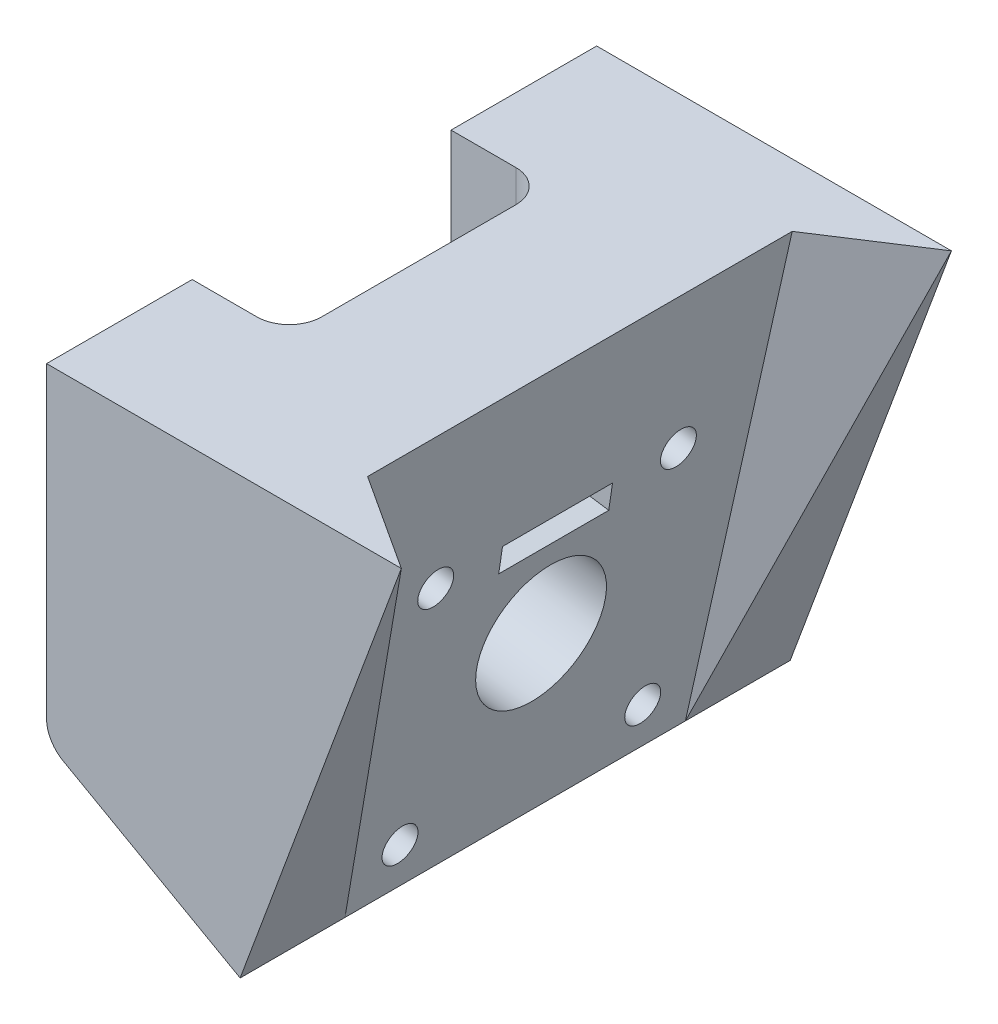
from build123d import *

# Parameters (mm, degrees)
EXTRUDE_1_DEPTH             = 34
CUT_EXTRUDE_1_DEPTH         = 34
CUT_EXTRUDE_12_DEPTH        = 147.490797926
FILLET_1_R                  = 2
CUT_EXTRUDE_13_DEPTH        = 166.02110084
CUT_EXTRUDE_14_DEPTH        = 141.242418962
CUT_EXTRUDE_15_DEPTH        = 141.242418962
EXTRUDE_2_DEPTH             = 34
CUT_EXTRUDE_16_DEPTH        = 141.410480916
EXTRUDE_3_REACH             = 158.273
EXTRUDE_3_DIRECTION_2_REACH = 158.273
SKETCH_24_R                 = 1.1
CUT_EXTRUDE_18_DEPTH        = 3.8
SKETCH_25_RX                = 2
SKETCH_25_RY                = 1.978256004
CUT_EXTRUDE_19_DEPTH        = 8
SKETCH_26_W                 = 6.8
SKETCH_26_H                 = 1.6
CUT_EXTRUDE_20_DEPTH        = 3
SKETCH_27_R                 = 4
SKETCH_27_RX                = 2
SKETCH_27_RY                = 1.978256004
CUT_EXTRUDE_21_DEPTH        = 5


with BuildPart() as part:
    # 草图1 → 凸台-拉伸1 (new body)
    with BuildSketch(Plane.XY):
        with BuildLine():
            Line((111.620742166, -71.457480545), (111.620742166, -52.448586741))
            Line((111.620742166, -52.448586741), (139.548665218, -52.448586741))
            Line((139.548665218, -52.448586741), (129.36488038, -79.948071529))
            ThreePointArc((129.36488038, -79.948071529), (128.178923794, -81.130879534), (126.509316799, -80.996938193))
            Line((126.509316799, -80.996938193), (112.640702972, -73.200903379))
            ThreePointArc((112.640702972, -73.200903379), (111.894463164, -72.467411635), (111.620742166, -71.457480545))
        make_face()
    extrude(amount=EXTRUDE_1_DEPTH)

    # 草图2 → 切除-拉伸1 (cut)
    with BuildSketch(Plane(origin=(0, -52.448586741, 0), x_dir=(1, 0, 0), z_dir=(0, 1, 0))):
        Polygon((129.36488038, -30), (129.36488038, -4), (139.548665218, 0), (139.548665218, -34), align=None)
    extrude(amount=-CUT_EXTRUDE_1_DEPTH, mode=Mode.SUBTRACT)

    # 草图14 → 切除-拉伸12 (cut, through all)
    with BuildSketch(Plane(origin=(0, -52.448586741, 0), x_dir=(1, 0, 0), z_dir=(0, 1, 0))):
        Polygon((111.620742166, -9), (111.620742166, -17), (111.620742166, -25), (117.620742166, -25), (117.620742166, -9), align=None)
    extrude(amount=-CUT_EXTRUDE_12_DEPTH, mode=Mode.SUBTRACT)

    # 圆角1
    fillet_1_edges = [part.edges().sort_by_distance(p)[0] for p in [
        (117.620742166, -64.22447251, 25),
        (117.620742166, -64.22447251, 9),
    ]]
    fillet(fillet_1_edges, radius=FILLET_1_R)

    # 草图15 → 切除-拉伸13 (cut, through all)
    with BuildSketch(Plane.XY.offset(34)):
        with BuildLine():
            Line((129.36488038, -79.948071529), (139.548665218, -52.448586741))
            Line((139.548665218, -52.448586741), (133.548665218, -52.448586741))
            Line((133.548665218, -52.448586741), (124.398706092, -77.156410579))
            ThreePointArc((124.398706092, -77.156410579), (123.212749507, -78.339218585), (121.543142511, -78.205277244))
            Line((121.543142511, -78.205277244), (126.509316799, -80.996938193))
            ThreePointArc((126.509316799, -80.996938193), (128.178923794, -81.130879534), (129.36488038, -79.948071529))
        make_face()
    extrude(amount=-CUT_EXTRUDE_13_DEPTH, mode=Mode.SUBTRACT)

    # 草图16 → 切除-拉伸14 (cut, through all)
    with BuildSketch(Plane(origin=(0, -52.448586741, 0), x_dir=(1, 0, 0), z_dir=(0, 1, 0))):
        Polygon((124.398706092, -5.950620272), (124.398706092, -28.049379728), (129.36488038, -30), (129.36488038, -4), align=None)
    extrude(amount=-CUT_EXTRUDE_14_DEPTH, mode=Mode.SUBTRACT)

    # 草图17 → 切除-拉伸15 (cut, through all)
    with BuildSketch(Plane(origin=(0, -52.448586741, 0), x_dir=(1, 0, 0), z_dir=(0, 1, 0))):
        Polygon((124.398706092, -5.950620272), (124.398706092, -28.049379728), (133.548665218, -34), (133.548665218, 0), align=None)
    extrude(amount=-CUT_EXTRUDE_15_DEPTH, mode=Mode.SUBTRACT)

    # 草图18 → 凸台-拉伸2 (add)
    with BuildSketch(Plane.XY.offset(34)):
        with BuildLine():
            Line((121.543142511, -78.205277244), (123.585184196, -79.353180579))
            Line((123.585184196, -79.353180579), (124.398706092, -77.156410579))
            ThreePointArc((124.398706092, -77.156410579), (123.212749507, -78.339218585), (121.543142511, -78.205277244))
        make_face()
    extrude(amount=-EXTRUDE_2_DEPTH)

    # 草图21 → 切除-拉伸16 (cut, through all)
    with BuildSketch(Plane(origin=(0, -52.448586741, 0), x_dir=(1, 0, 0), z_dir=(0, 1, 0))):
        Polygon((123.585184196, -6.47968929), (123.585184196, -27.52031071), (124.398706092, -28.049379728), (124.398706092, -5.950620272), align=None)
    extrude(amount=-CUT_EXTRUDE_16_DEPTH, mode=Mode.SUBTRACT)

    # 凸台-拉伸3: up to this plane
    extrude_3_end = Plane(origin=(133.548665218, -78.46185441, 34), z_dir=(-0.5451910137179772, 0, 0.8383118504239127))
    # 草图22 → 凸台-拉伸3 (add, up to the surface)
    with BuildSketch(Plane.XY.offset(17), mode=Mode.PRIVATE) as extrude_3_sk1:
        Polygon((127.585184196, -52.448586741), (123.585184196, -79.353180579), (123.585184196, -52.448586741), align=None)
    extrude_3_tool1 = split(extrude(extrude_3_sk1.sketch, amount=EXTRUDE_3_REACH, mode=Mode.PRIVATE), bisect_by=extrude_3_end, keep=Keep.BOTH, mode=Mode.PRIVATE)
    add(extrude_3_tool1.solids().sort_by_distance((124.918518, -61.416785, 17))[0])

    # 凸台-拉伸3 direction 2: up to this plane
    extrude_3_direction_2_end = Plane(origin=(133.548665218, -78.46185441, 0), z_dir=(-0.5451910137179766, 0, -0.838311850423913))
    # 草图22 → 凸台-拉伸3 direction 2 (add, up to the surface)
    with BuildSketch(Plane.XY.offset(17), mode=Mode.PRIVATE) as extrude_3_direction_2_sk1:
        Polygon((127.585184196, -52.448586741), (123.585184196, -79.353180579), (123.585184196, -52.448586741), align=None)
    extrude_3_direction_2_tool1 = split(extrude(extrude_3_direction_2_sk1.sketch, amount=-EXTRUDE_3_DIRECTION_2_REACH, mode=Mode.PRIVATE), bisect_by=extrude_3_direction_2_end, keep=Keep.BOTH, mode=Mode.PRIVATE)
    add(extrude_3_direction_2_tool1.solids().sort_by_distance((124.918518, -61.416785, 17))[0])

    # 草图24 → 切除-拉伸18 (cut)
    with BuildSketch(Plane(origin=(132.455135986, -19.69256801, -116.943153128), x_dir=(0, 0, -1), z_dir=(0.9891280019770362, -0.1470571171515218, 0))):
        with Locations(Location((-141.443153128, -57.716372046, 0), (0, 0, 90))):
            Circle(SKETCH_24_R)
        with Locations(Location((-126.443153128, -57.716372046, 0), (0, 0, 90))):
            Circle(SKETCH_24_R)
        with Locations(Location((-141.443153128, -42.716372046, 0), (0, 0, 90))):
            Circle(SKETCH_24_R)
        with Locations(Location((-126.443153128, -42.716372046, 0), (0, 0, 90))):
            Circle(SKETCH_24_R)
    extrude(amount=-CUT_EXTRUDE_18_DEPTH, mode=Mode.SUBTRACT)

    # 草图25 → 切除-拉伸19 (cut)
    with BuildSketch(Plane(origin=(132.455135986, -19.69256801, -116.943153128), x_dir=(0, 0, -1), z_dir=(0.9891280019770362, -0.1470571171515218, 0))):
        with Locations((-133.943153128, -49.444294674)):
            Ellipse(SKETCH_25_RX, SKETCH_25_RY)
    extrude(amount=-CUT_EXTRUDE_19_DEPTH, mode=Mode.SUBTRACT)

    # 草图26 → 切除-拉伸20 (cut)
    with BuildSketch(Plane(origin=(132.455135986, -19.69256801, -116.943153128), x_dir=(0, 0, -1), z_dir=(0.9891280019770362, -0.1470571171515218, 0))):
        with Locations((-133.943153128, -43.316372046)):
            Rectangle(SKETCH_26_W, SKETCH_26_H)
    extrude(amount=-CUT_EXTRUDE_20_DEPTH, mode=Mode.SUBTRACT)

    # 草图27 → 切除-拉伸21 (cut)
    with BuildSketch(Plane(origin=(132.455135986, -19.69256801, 0), x_dir=(0, 0, -1), z_dir=(0.9891280019770362, -0.1470571171515218, 0))):
        with Locations(Location((-17, -49.444294674, 0), (0, 0, 90))):
            Circle(SKETCH_27_R)
        with Locations((-17, -49.444294674)):
            Ellipse(SKETCH_27_RX, SKETCH_27_RY, mode=Mode.SUBTRACT)
    extrude(amount=-CUT_EXTRUDE_21_DEPTH, mode=Mode.SUBTRACT)


solid = part.part
